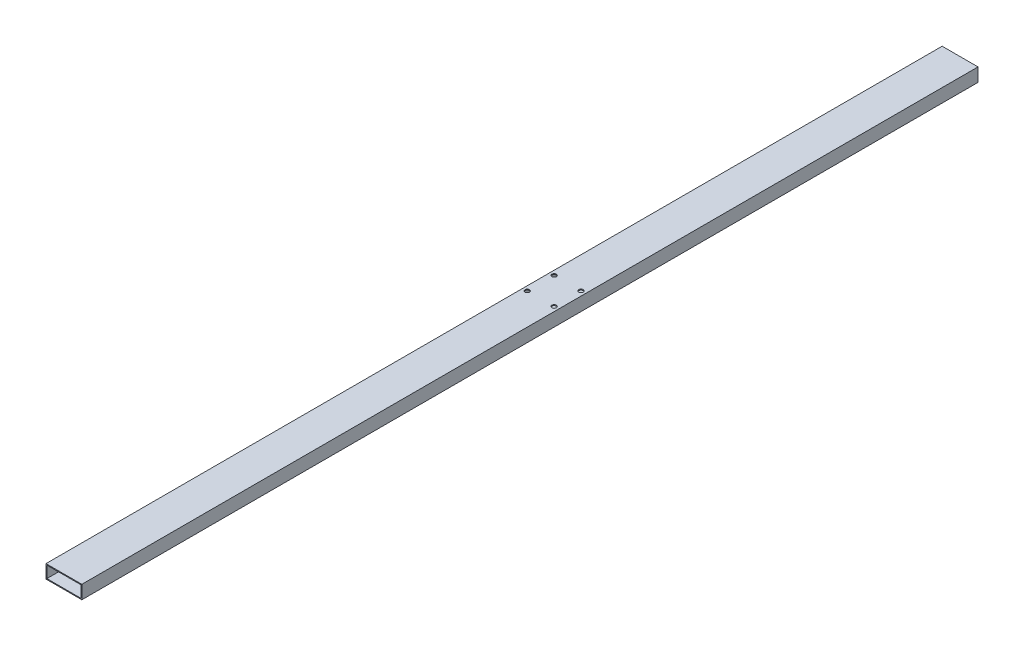
from build123d import *

# Parameters (mm, degrees)
SKETCH_1_W          = 40
SKETCH_1_H          = 15
SKETCH_1_W_2        = 38
SKETCH_1_H_2        = 13
EXTRUDE_1_DEPTH     = 1000
SKETCH_3_R          = 2.5
CUT_EXTRUDE_2_DEPTH = 1001.912084051


with BuildPart() as part:
    # 草图1 → 凸台-拉伸1 (new body)
    with BuildSketch(Plane.XY):
        with Locations((20, 7.5)):
            Rectangle(SKETCH_1_W, SKETCH_1_H)
        with Locations((20, 7.5)):
            Rectangle(SKETCH_1_W_2, SKETCH_1_H_2, mode=Mode.SUBTRACT)
    extrude(amount=EXTRUDE_1_DEPTH)

    # 草图3 → 切除-拉伸2 (cut, through all)
    with BuildSketch(Plane.XZ):
        with Locations(Location((35, 468, 0), (0, 0, 270))):
            Circle(SKETCH_3_R)
        with Locations(Location((35, 438, 0), (0, 0, 270))):
            Circle(SKETCH_3_R)
        with Locations(Location((5, 468, 0), (0, 0, 270))):
            Circle(SKETCH_3_R)
        with Locations(Location((5, 438, 0), (0, 0, 270))):
            Circle(SKETCH_3_R)
    extrude(amount=-CUT_EXTRUDE_2_DEPTH, mode=Mode.SUBTRACT)


solid = part.part
